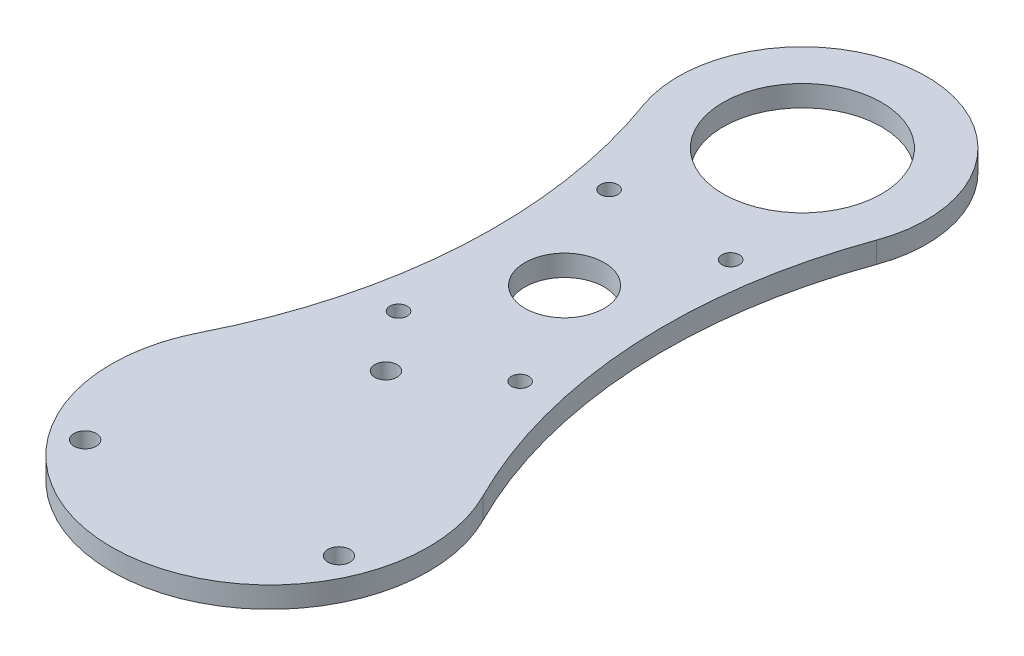
from build123d import *

# Parameters (mm, degrees)
EXTRUDE_1_DEPTH          = 4
SKETCH_2_R               = 2.1
CUT_EXTRUDE_1_DEPTH      = 4
PATTERN_CIRCULAR_1_COUNT = 3
SKETCH_4_R               = 7.5
CUT_EXTRUDE_2_DEPTH      = 27.5
SKETCH_5_R               = 1.65
CUT_EXTRUDE_3_DEPTH      = 27.5
PATTERN_CIRCULAR_2_COUNT = 3
SKETCH_6_R               = 15
CUT_EXTRUDE_4_DEPTH      = 29.5


with BuildPart() as part:
    # 草图1 → 凸台-拉伸1 (new body)
    with BuildSketch(Plane(origin=(0, 0, 0), x_dir=(1, 0, 0), z_dir=(0, 1, 0))):
        with BuildLine():
            ThreePointArc((26.78524518, 13.511130252), (16.244949948, 52.625392683), (22.086079359, 92.711606726))
            ThreePointArc((22.086079359, 92.711606726), (0, 124.24), (-22.086079359, 92.711606726))
            ThreePointArc((-22.086079359, 92.711606726), (-16.244949948, 52.625392683), (-26.78524518, 13.511130252))
            ThreePointArc((-26.78524518, 13.511130252), (0, -30), (26.78524518, 13.511130252))
        make_face()
    extrude(amount=EXTRUDE_1_DEPTH)

    # 草图2 → 切除-拉伸1 (cut)
    with BuildSketch(Plane(origin=(0, 4, 0), x_dir=(1, 0, 0), z_dir=(0, 1, 0))):
        with Locations(Location((22.952521328, -9.908671188, 0), (0, 0, 270))):
            Circle(SKETCH_2_R)
    cut_extrude_1 = extrude(amount=-CUT_EXTRUDE_1_DEPTH, mode=Mode.SUBTRACT)

    # 阵列(圆周)1: 切除-拉伸1 ×3 about axis
    pattern_circular_1_axis = Axis((0, 0, 0), (0, 1, 0))
    for i in range(1, PATTERN_CIRCULAR_1_COUNT):
        add(cut_extrude_1.rotate(pattern_circular_1_axis, i * 360 / PATTERN_CIRCULAR_1_COUNT), mode=Mode.SUBTRACT)

    # 草图4 → 切除-拉伸2 (cut)
    with BuildSketch(Plane(origin=(0, 0, 0), x_dir=(-1, 0, 0), z_dir=(0, -1, 0))):
        with Locations(Location((0, 55.74, 0), (0, 0, 90))):
            Circle(SKETCH_4_R)
    extrude(amount=-CUT_EXTRUDE_2_DEPTH, mode=Mode.SUBTRACT)

    # 草图5 → 切除-拉伸3 (cut)
    with BuildSketch(Plane.XZ):
        with Locations(Location((-11.5, -35.821415713, 0), (0, 0, 270))):
            Circle(SKETCH_5_R)
        with Locations(Location((11.5, -35.821415713, 0), (0, 0, 270))):
            Circle(SKETCH_5_R)
    cut_extrude_3 = extrude(amount=-CUT_EXTRUDE_3_DEPTH, mode=Mode.SUBTRACT)

    # 阵列(圆周)2: 切除-拉伸3 ×3 about axis
    pattern_circular_2_axis = Axis((0, 0, -55.74), (0, 1, 0))
    for i in range(1, PATTERN_CIRCULAR_2_COUNT):
        add(cut_extrude_3.rotate(pattern_circular_2_axis, i * 360 / PATTERN_CIRCULAR_2_COUNT), mode=Mode.SUBTRACT)

    # 草图6 → 切除-拉伸4 (cut)
    with BuildSketch(Plane.XZ):
        with Locations(Location((0, -100.74, 0), (0, 0, 270))):
            Circle(SKETCH_6_R)
    extrude(amount=-CUT_EXTRUDE_4_DEPTH, mode=Mode.SUBTRACT)


solid = part.part
